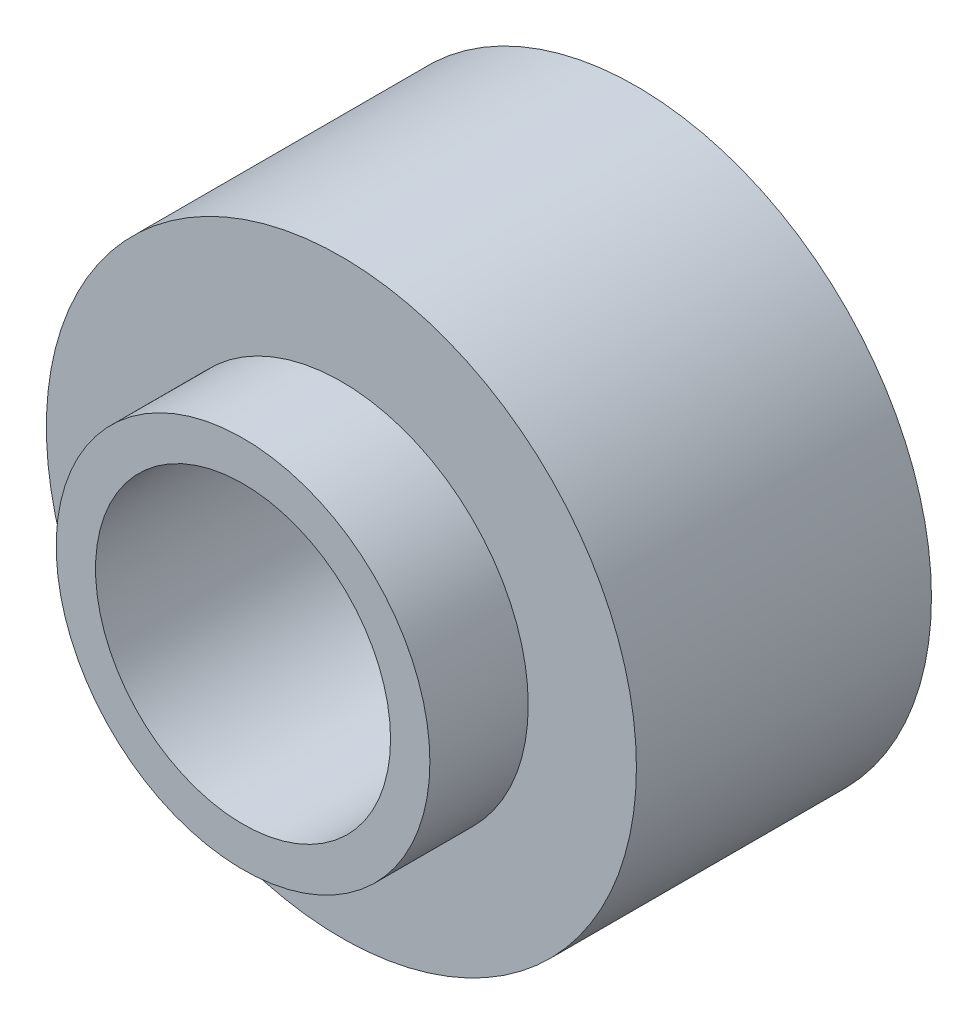
from build123d import *

# Parameters (mm, degrees)
SKETCH2_R           = 0.375
SKETCH2_R_2         = 0.1875
BOSS_EXTRUDE1_DEPTH = 0.5
CUT_EXTRUDE1_START  = -0.125
SKETCH3_R           = 0.375
SKETCH3_R_2         = 0.2375
CUT_EXTRUDE1_DEPTH  = 0.125


with BuildPart() as part:
    # Sketch2 → Boss-Extrude1 (new body)
    with BuildSketch(Plane.XY):
        Circle(SKETCH2_R)
        Circle(SKETCH2_R_2, mode=Mode.SUBTRACT)
    extrude(amount=BOSS_EXTRUDE1_DEPTH)

    # Sketch3 → Cut-Extrude1 (cut)
    with BuildSketch(Plane.XY.offset(0.5).offset(CUT_EXTRUDE1_START)):
        Circle(SKETCH3_R)
        Circle(SKETCH3_R_2, mode=Mode.SUBTRACT)
    extrude(amount=CUT_EXTRUDE1_DEPTH, mode=Mode.SUBTRACT)


solid = part.part
